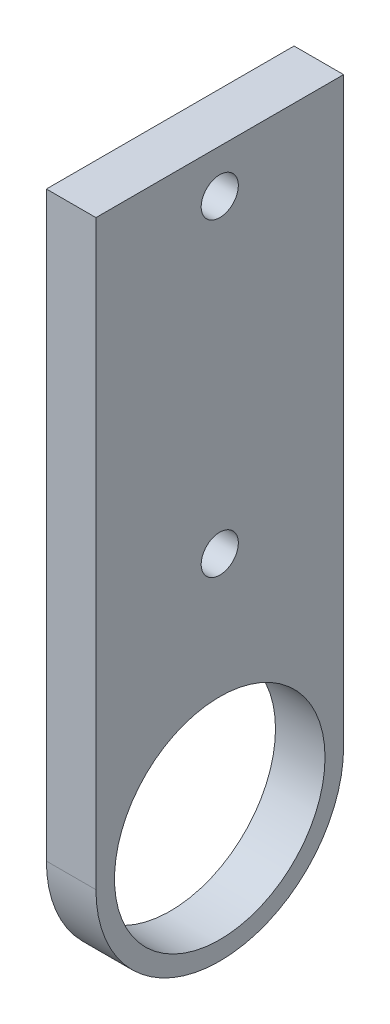
from build123d import *

# Parameters (mm, degrees)
SKETCH_1_R      = 1.5
SKETCH_1_R_2    = 8.5
EXTRUDE_1_DEPTH = 4


with BuildPart() as part:
    # 草图1 → 凸台-拉伸1 (new body)
    with BuildSketch(Plane(origin=(0, 0, 0), x_dir=(0, 0, -1), z_dir=(1, 0, 0))):
        with BuildLine():
            Line((-10, 26), (-10, -21))
            ThreePointArc((-10, -21), (0, -31), (10, -21))
            Line((10, -21), (10, 26))
            Line((10, 26), (-10, 26))
        make_face()
        with Locations((0, 22.5)):
            Circle(SKETCH_1_R, mode=Mode.SUBTRACT)
        with Locations((0, -21)):
            Circle(SKETCH_1_R_2, mode=Mode.SUBTRACT)
        with Locations((0, -2.5)):
            Circle(SKETCH_1_R, mode=Mode.SUBTRACT)
    extrude(amount=EXTRUDE_1_DEPTH)


solid = part.part
